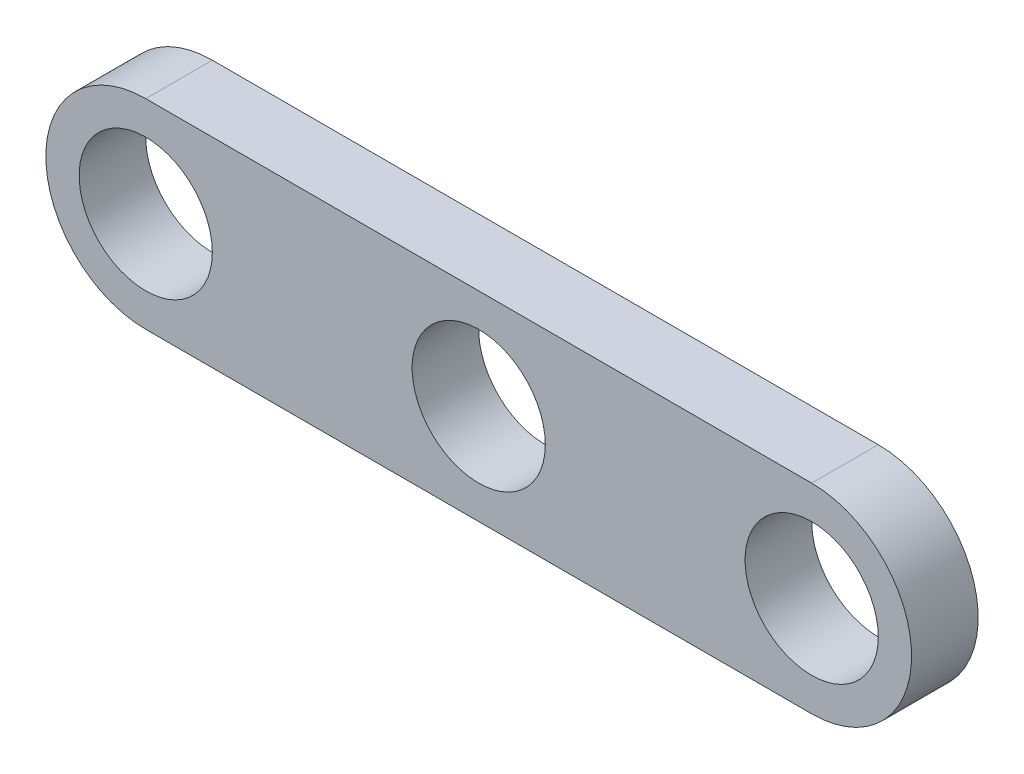
from build123d import *

# Parameters (mm, degrees)
SKETCH2_W           = 20
SKETCH2_H           = 6
BOSS_EXTRUDE2_DEPTH = 2
CUT_EXTRUDE1_DEPTH  = 6


with BuildPart() as part:
    # Sketch2 → Boss-Extrude2 (new body)
    with BuildSketch(Plane.XY):
        with BuildLine():
            Line((-20, 0), (-20, 6))
            ThreePointArc((-20, 6), (-23, 3), (-20, 0))
        make_face()
        with Locations((-10, 3)):
            Rectangle(SKETCH2_W, SKETCH2_H)
        with BuildLine():
            Line((0, 0), (0, 6))
            ThreePointArc((0, 6), (3, 3), (0, 0))
        make_face()
    extrude(amount=BOSS_EXTRUDE2_DEPTH)

    # Sketch4 → Cut-Extrude1 (cut)
    with BuildSketch(Plane.XY.offset(2)):
        with BuildLine():
            ThreePointArc((-18, 3), (-18.585786438, 4.414213562), (-20, 5))
            Line((-20, 5), (-20, 1))
            ThreePointArc((-20, 1), (-18.585786438, 1.585786438), (-18, 3))
        make_face()
        with BuildLine():
            Line((-20, 1), (-20, 5))
            ThreePointArc((-20, 5), (-22, 3), (-20, 1))
        make_face()
        with BuildLine():
            ThreePointArc((-8, 3), (-8.585786438, 4.414213562), (-10, 5))
            Line((-10, 5), (-10, 1))
            ThreePointArc((-10, 1), (-8.585786438, 1.585786438), (-8, 3))
        make_face()
        with BuildLine():
            Line((-10, 1), (-10, 5))
            ThreePointArc((-10, 5), (-12, 3), (-10, 1))
        make_face()
        with BuildLine():
            ThreePointArc((2, 3), (1.414213562, 4.414213562), (0, 5))
            Line((0, 5), (0, 1))
            ThreePointArc((0, 1), (1.414213562, 1.585786438), (2, 3))
        make_face()
        with BuildLine():
            Line((0, 1), (0, 5))
            ThreePointArc((0, 5), (-2, 3), (0, 1))
        make_face()
    extrude(amount=-CUT_EXTRUDE1_DEPTH, mode=Mode.SUBTRACT)


solid = part.part
